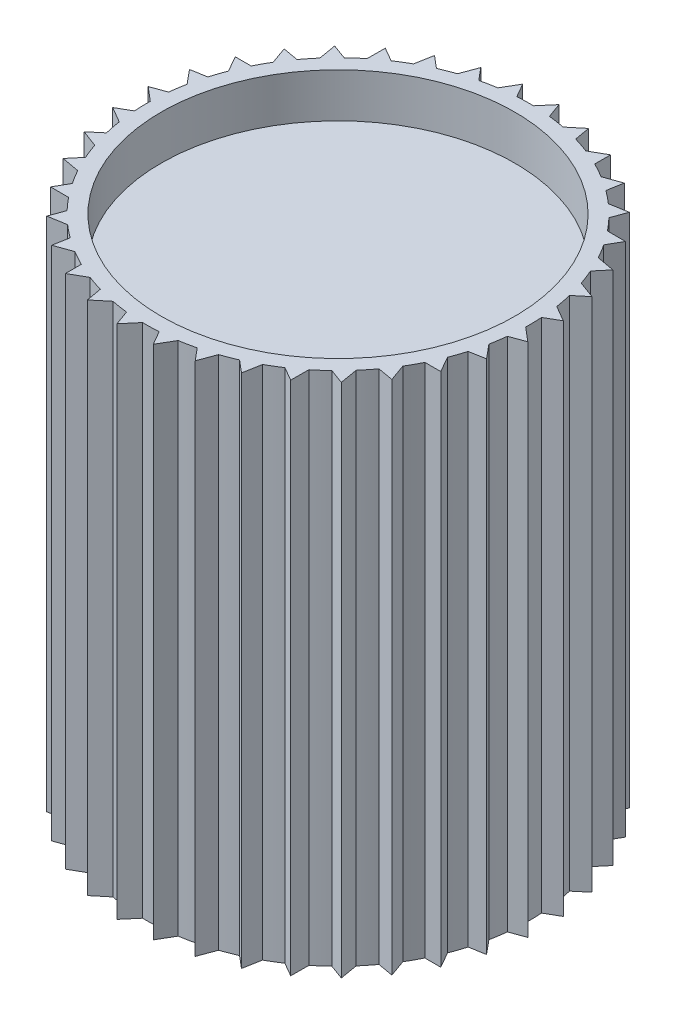
from build123d import *

# Parameters (mm, degrees)
SKETCH_1_R          = 13
EXTRUDE_1_DEPTH     = 35
SKETCH_2_R          = 12
CUT_EXTRUDE_1_DEPTH = 3
EXTRUDE_2_DEPTH     = 35


with BuildPart() as part:
    # 草图1 → 凸台-拉伸1 (new body)
    with BuildSketch(Plane(origin=(0, 0, 0), x_dir=(1, 0, 0), z_dir=(0, 1, 0))):
        with Locations(Location((0, 0, 0), (0, 0, 270))):
            Circle(SKETCH_1_R)
    extrude(amount=EXTRUDE_1_DEPTH)

    # 草图2 → 切除-拉伸1 (cut)
    with BuildSketch(Plane(origin=(0, 35, 0), x_dir=(1, 0, 0), z_dir=(0, 1, 0))):
        with Locations(Location((0, 0, 0), (0, 0, 270))):
            Circle(SKETCH_2_R)
    extrude(amount=-CUT_EXTRUDE_1_DEPTH, mode=Mode.SUBTRACT)

    # 草图3 → 凸台-拉伸2 (add, through all)
    with BuildSketch(Plane(origin=(0, 35, 0), x_dir=(1, 0, 0), z_dir=(0, 1, 0))):
        Polygon((-12.123665589, 4.692199131), (-11.044603538, 4.692199131), (-11.653830585, 5.760922904), (-12.732892635, 5.760922904), align=None)
        Polygon((-11.124688039, 6.726166519), (-10.062019365, 6.53878936), (-10.476408948, 7.697067984), (-11.539077622, 7.884445143), align=None)
        Polygon((-9.787692472, 8.555762741), (-8.773705825, 8.186701784), (-8.980666927, 9.399341549), (-9.994653573, 9.768402506), align=None)
        Polygon((-8.153302822, 10.125396442), (-7.218807673, 9.585865416), (-7.212051886, 10.816020876), (-8.146547034, 11.355551902), align=None)
        Polygon((-6.271179191, 11.387375095), (-5.444569703, 10.693767379), (-5.224302297, 11.904060883), (-6.050911785, 12.597668599), align=None)
        Polygon((-4.198508954, 12.303354118), (-3.504901238, 11.47674463), (-3.077814927, 12.630402023), (-3.771422644, 13.457011511), align=None)
        Polygon((-1.998269147, 12.845501953), (-1.458738122, 11.911006804), (-0.837809708, 12.97297479), (-1.377340734, 13.907469938), align=None)
        Polygon((0.262687056, 12.99734571), (0.631748014, 11.983359064), (1.427651935, 12.921370282), (1.058590978, 13.935356928), align=None)
        Polygon((2.515661647, 12.754271695), (2.703038805, 11.691603022), (3.649735097, 12.477156476), (3.462357938, 13.53982515), align=None)
        Polygon((4.692199131, 12.123665589), (4.692199131, 11.044603538), (5.760922904, 11.653830585), (5.760922904, 12.732892635), align=None)
        Polygon((6.726166519, 11.124688039), (6.53878936, 10.062019365), (7.697067984, 10.476408948), (7.884445143, 11.539077622), align=None)
        Polygon((8.555762741, 9.787692472), (8.186701784, 8.773705825), (9.399341549, 8.980666927), (9.768402506, 9.994653573), align=None)
        Polygon((10.125396442, 8.153302822), (9.585865416, 7.218807673), (10.816020876, 7.212051886), (11.355551902, 8.146547034), align=None)
        Polygon((11.387375095, 6.271179191), (10.693767379, 5.444569703), (11.904060883, 5.224302297), (12.597668599, 6.050911785), align=None)
        Polygon((12.303354118, 4.198508954), (11.47674463, 3.504901238), (12.630402023, 3.077814927), (13.457011511, 3.771422644), align=None)
        Polygon((12.845501953, 1.998269147), (11.911006804, 1.458738122), (12.97297479, 0.837809708), (13.907469938, 1.377340734), align=None)
        Polygon((12.99734571, -0.262687056), (11.983359064, -0.631748014), (12.921370282, -1.427651935), (13.935356928, -1.058590978), align=None)
        Polygon((12.754271695, -2.515661647), (11.691603022, -2.703038805), (12.477156476, -3.649735097), (13.53982515, -3.462357938), align=None)
        Polygon((12.123665589, -4.692199131), (11.044603538, -4.692199131), (11.653830585, -5.760922904), (12.732892635, -5.760922904), align=None)
        Polygon((11.124688039, -6.726166519), (10.062019365, -6.53878936), (10.476408948, -7.697067984), (11.539077622, -7.884445143), align=None)
        Polygon((9.787692472, -8.555762741), (8.773705825, -8.186701784), (8.980666927, -9.399341549), (9.994653573, -9.768402506), align=None)
        Polygon((8.153302822, -10.125396442), (7.218807673, -9.585865416), (7.212051886, -10.816020876), (8.146547034, -11.355551902), align=None)
        Polygon((6.271179191, -11.387375095), (5.444569703, -10.693767379), (5.224302297, -11.904060883), (6.050911785, -12.597668599), align=None)
        Polygon((4.198508954, -12.303354118), (3.504901238, -11.47674463), (3.077814927, -12.630402023), (3.771422644, -13.457011511), align=None)
        Polygon((1.998269147, -12.845501953), (1.458738122, -11.911006804), (0.837809708, -12.97297479), (1.377340734, -13.907469938), align=None)
        Polygon((-0.262687056, -12.99734571), (-0.631748014, -11.983359064), (-1.427651935, -12.921370282), (-1.058590978, -13.935356928), align=None)
        Polygon((-2.515661647, -12.754271695), (-2.703038805, -11.691603022), (-3.649735097, -12.477156476), (-3.462357938, -13.53982515), align=None)
        Polygon((-4.692199131, -12.123665589), (-4.692199131, -11.044603538), (-5.760922904, -11.653830585), (-5.760922904, -12.732892635), align=None)
        Polygon((-6.726166519, -11.124688039), (-6.53878936, -10.062019365), (-7.697067984, -10.476408948), (-7.884445143, -11.539077622), align=None)
        Polygon((-8.555762741, -9.787692472), (-8.186701784, -8.773705825), (-9.399341549, -8.980666927), (-9.768402506, -9.994653573), align=None)
        Polygon((-10.125396442, -8.153302822), (-9.585865416, -7.218807673), (-10.816020876, -7.212051886), (-11.355551902, -8.146547034), align=None)
        Polygon((-11.387375095, -6.271179191), (-10.693767379, -5.444569703), (-11.904060883, -5.224302297), (-12.597668599, -6.050911785), align=None)
        Polygon((-12.303354118, -4.198508954), (-11.47674463, -3.504901238), (-12.630402023, -3.077814927), (-13.457011511, -3.771422644), align=None)
        Polygon((-12.845501953, -1.998269147), (-11.911006804, -1.458738122), (-12.97297479, -0.837809708), (-13.907469938, -1.377340734), align=None)
        Polygon((-12.99734571, 0.262687056), (-11.983359064, 0.631748014), (-12.921370282, 1.427651935), (-13.935356928, 1.058590978), align=None)
        Polygon((-12.754271695, 2.515661647), (-11.691603022, 2.703038805), (-12.477156476, 3.649735097), (-13.53982515, 3.462357938), align=None)
    extrude(amount=-EXTRUDE_2_DEPTH)


solid = part.part
